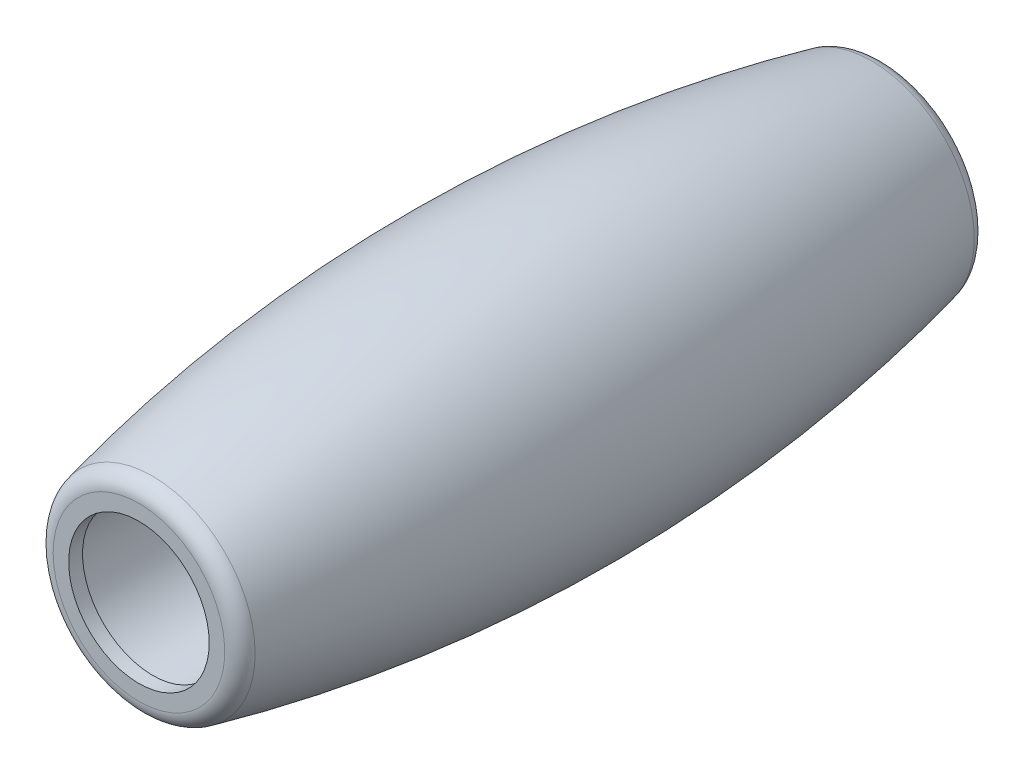
from build123d import *

# Parameters (mm, degrees)
FILLET1_R = 1


with BuildPart() as part:
    # Sketch1 → Revolve1 (revolve)
    with BuildSketch(Plane(origin=(0, 0, 0), x_dir=(0, 0, -1), z_dir=(1, 0, 0)), mode=Mode.PRIVATE) as revolve1_sk:
        with BuildLine():
            Line((21.5, 5.738508096), (21.5, 4.05))
            Line((21.5, 4.05), (20.7, 4.05))
            Line((20.7, 4.05), (20.7, 4.5))
            Line((20.7, 4.5), (-20.7, 4.5))
            Line((-20.7, 4.5), (-20.7, 4.05))
            Line((-20.7, 4.05), (-21.5, 4.05))
            Line((-21.5, 4.05), (-21.5, 5.738508096))
            ThreePointArc((-21.5, 5.738508096), (0, 8.25), (21.5, 5.738508096))
        make_face()
    revolve(revolve1_sk.sketch.rotate(Axis((0, 0, 21.5), (0, 0, -1)), 90), axis=Axis((0, 0, 21.5), (0, 0, -1)))

    # Fillet1
    fillet1_edges = [part.edges().sort_by_distance(p)[0] for p in [
        (-5.738508096, 0, -21.5),
        (-5.738508096, 0, 21.5),
    ]]
    fillet(fillet1_edges, radius=FILLET1_R)


solid = part.part
